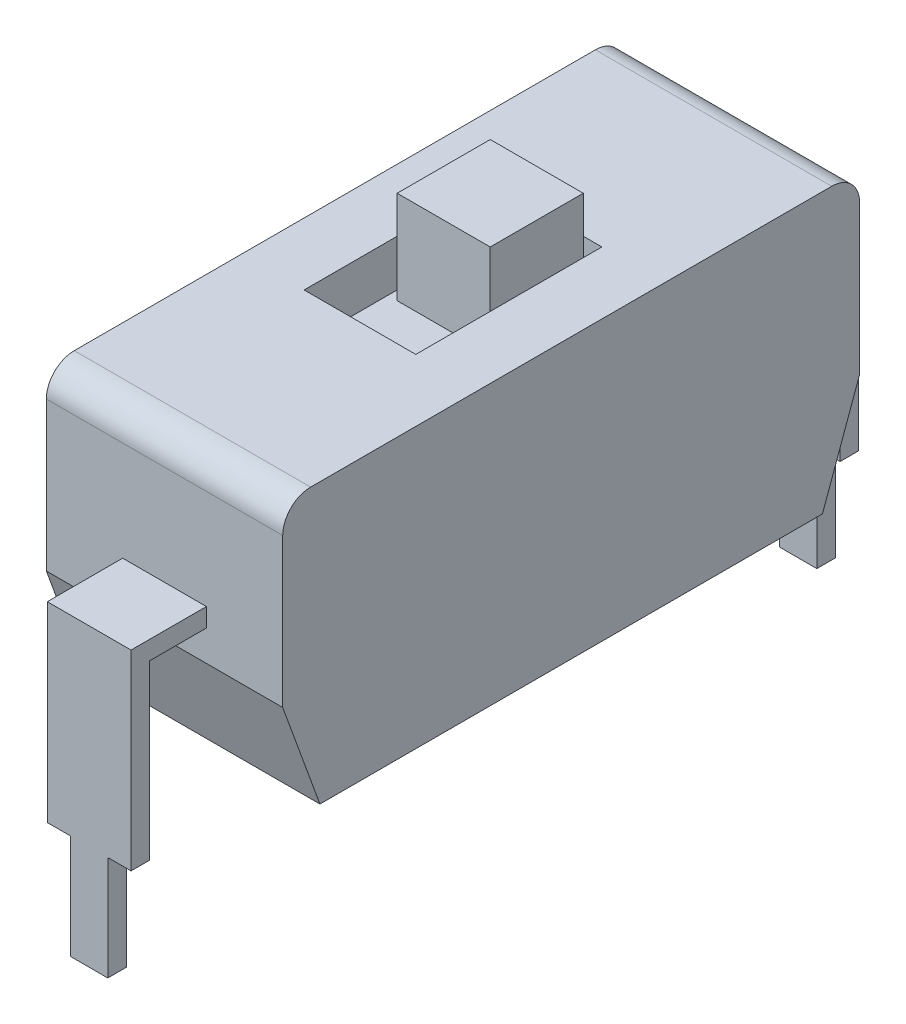
from build123d import *

# Parameters (mm, degrees)
SKETCH_1_W           = 2.54
SKETCH_1_H           = 6.2
EXTRUDE_1_DEPTH      = 3
SKETCH_2_W           = 1.2
SKETCH_2_H           = 2
CUT_EXTRUDE_1_DEPTH  = 0.5
SKETCH_3_W           = 1
SKETCH_3_H           = 1
EXTRUDE_1_2_DEPTH    = 1
FILLET_1_R           = 0.3
CHAMFER_1_SIZE       = 0.4
CHAMFER_1_SIZE2      = 1.098990968
EXTRUDE_2_DEPTH      = 0.45
EXTRUDE_2_DEPTH_BACK = 0.45
SKETCH_5_W           = 0.25
SKETCH_5_H           = 1.121567526
CUT_EXTRUDE_2_DEPTH  = 9.661137339


with BuildPart() as part:
    # 草图1 → Extrude 1 (new body)
    with BuildSketch(Plane(origin=(0, 0, 0), x_dir=(1, 0, 0), z_dir=(0, 1, 0))):
        Rectangle(SKETCH_1_W, SKETCH_1_H)
    extrude(amount=EXTRUDE_1_DEPTH)

    # 草图2 → 切除-拉伸1 (cut)
    with BuildSketch(Plane(origin=(0, 3, 0), x_dir=(1, 0, 0), z_dir=(0, 1, 0))):
        Rectangle(SKETCH_2_W, SKETCH_2_H)
    extrude(amount=-CUT_EXTRUDE_1_DEPTH, mode=Mode.SUBTRACT)

    # 草图3 → Extrude 1 2 (add)
    with BuildSketch(Plane(origin=(0, 2.5, 0), x_dir=(1, 0, 0), z_dir=(0, 1, 0))):
        with Locations((0, 0.4)):
            Rectangle(SKETCH_3_W, SKETCH_3_H)
    extrude(amount=EXTRUDE_1_2_DEPTH)

    # 圆角1
    fillet_1_edges = [part.edges().sort_by_distance(p)[0] for p in [
        (0, 3, -3.1),
        (0, 3, 3.1),
    ]]
    fillet(fillet_1_edges, radius=FILLET_1_R)

    # 倒角1
    chamfer_1_edges = [part.edges().sort_by_distance(p)[0] for p in [
        (0, 0, -3.1),
        (0, 0, 3.1),
    ]]
    chamfer_1_side = [part.faces().sort_by_distance(p)[0] for p in [
        (0, 0, 0),
    ]]
    chamfer(chamfer_1_edges, length=CHAMFER_1_SIZE, length2=CHAMFER_1_SIZE2, reference=chamfer_1_side[0])

    # 草图4 → 凸台-拉伸2 (add, two sides: drawn at the far end of the back side and taken through both)
    with BuildSketch(Plane(origin=(0, 0, 0), x_dir=(0, 0, -1), z_dir=(1, 0, 0)).offset(-EXTRUDE_2_DEPTH_BACK)):
        Polygon((-2.805439179, 1.628598981), (-3.91, 1.628598981), (-3.91, -1.548691293), (-3.71, -1.548691293), (-3.71, 1.428598981), (-2.805439179, 1.428598981), align=None)
        Polygon((2.805439179, 1.428598981), (2.805439179, 1.628598981), (3.91, 1.628598981), (3.91, -1.548691293), (3.71, -1.548691293), (3.71, 1.428598981), align=None)
    extrude(amount=EXTRUDE_2_DEPTH + EXTRUDE_2_DEPTH_BACK)

    # 草图5 → 切除-拉伸2 (cut, through all)
    with BuildSketch(Plane.XY.offset(3.91)):
        with Locations((0.325, -0.98790753)):
            Rectangle(SKETCH_5_W, SKETCH_5_H)
        with Locations((-0.325, -0.98790753)):
            Rectangle(SKETCH_5_W, SKETCH_5_H)
    extrude(amount=-CUT_EXTRUDE_2_DEPTH, mode=Mode.SUBTRACT)


solid = part.part
